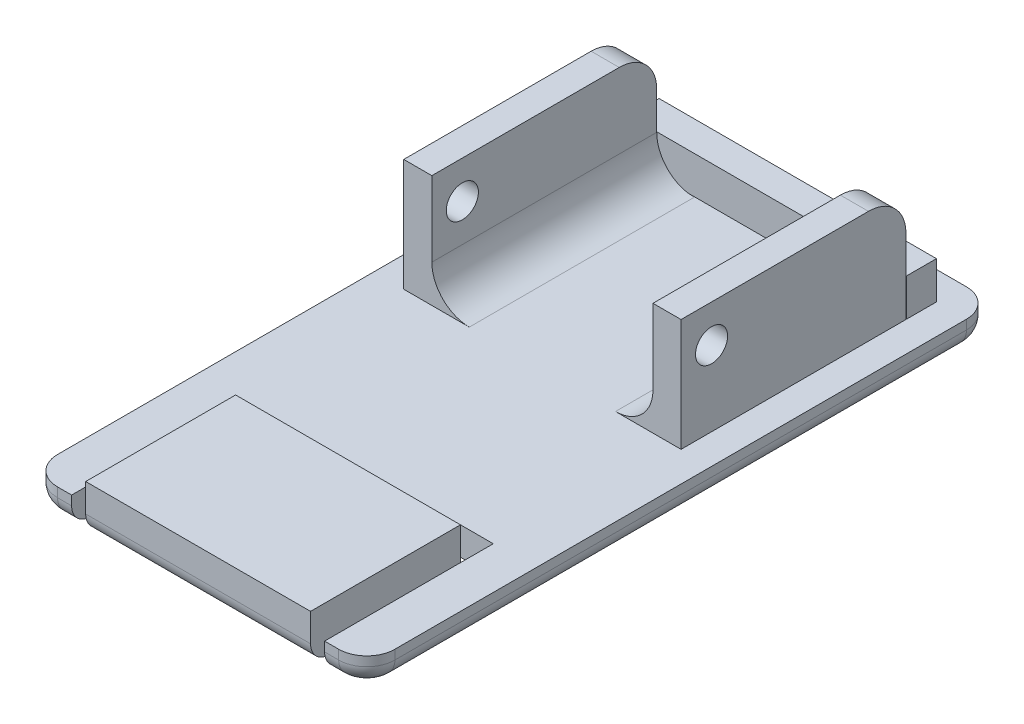
from build123d import *

# Parameters (mm, degrees)
SKETCH_1_W          = 18
SKETCH_1_H          = 33.5
EXTRUDE_1_DEPTH     = 1.5
FILLET_1_R          = 1.5
SKETCH_2_W          = 1.5
SKETCH_2_H          = 12
EXTRUDE_2_DEPTH     = 6
SKETCH_3_W          = 14.8
SKETCH_3_H          = 1.6
EXTRUDE_3_DEPTH     = 2
FILLET_2_R          = 2
SKETCH_4_R          = 0.856485036
CUT_EXTRUDE_1_DEPTH = 18
SKETCH_5_W          = 12
SKETCH_5_H          = 8
EXTRUDE_4_DEPTH     = 1
FILLET_3_R          = 1
CUT_EXTRUDE_2_DEPTH = 10


with BuildPart() as part:
    # 草图1 → 凸台-拉伸1 (new body)
    with BuildSketch(Plane(origin=(0, 0, 0), x_dir=(1, 0, 0), z_dir=(0, 1, 0))):
        Rectangle(SKETCH_1_W, SKETCH_1_H)
    extrude(amount=EXTRUDE_1_DEPTH)

    # 圆角1
    fillet_1_edges = [part.edges().sort_by_distance(p)[0] for p in [
        (-9, 0.75, -16.75),
        (9, 0.75, -16.75),
        (9, 0.75, 16.75),
        (-9, 0.75, 16.75),
    ]]
    fillet(fillet_1_edges, radius=FILLET_1_R)

    # 草图2 → 凸台-拉伸2 (add)
    with BuildSketch(Plane(origin=(0, 1.5, 0), x_dir=(1, 0, 0), z_dir=(0, 1, 0))):
        with Locations((-6.65, 7.622409508)):
            Rectangle(SKETCH_2_W, SKETCH_2_H)
        with Locations((6.65, 7.622409508)):
            Rectangle(SKETCH_2_W, SKETCH_2_H)
    extrude(amount=EXTRUDE_2_DEPTH)

    # 草图3 → 凸台-拉伸3 (add)
    with BuildSketch(Plane(origin=(0, 1.5, 0), x_dir=(1, 0, 0), z_dir=(0, 1, 0))):
        with Locations((0, 14.45)):
            Rectangle(SKETCH_3_W, SKETCH_3_H)
    extrude(amount=EXTRUDE_3_DEPTH)

    # 圆角2
    fillet_2_edges = [part.edges().sort_by_distance(p)[0] for p in [
        (-5.9, 1.5, -7.622409508),
        (-6.65, 7.5, -13.622409508),
        (5.9, 1.5, -7.622409508),
        (6.65, 7.5, -13.622409508),
    ]]
    fillet(fillet_2_edges, radius=FILLET_2_R)

    # 草图4 → 切除-拉伸1 (cut)
    with BuildSketch(Plane(origin=(7.4, 0, 0), x_dir=(0, 0, -1), z_dir=(1, 0, 0))):
        with Locations((3.25, 5.5)):
            Circle(SKETCH_4_R)
    extrude(amount=-CUT_EXTRUDE_1_DEPTH, mode=Mode.SUBTRACT)

    # 草图5 → 凸台-拉伸4 (add)
    with BuildSketch(Plane(origin=(0, 1.5, 0), x_dir=(1, 0, 0), z_dir=(0, 1, 0))):
        with Locations((0, -12.75)):
            Rectangle(SKETCH_5_W, SKETCH_5_H)
    extrude(amount=EXTRUDE_4_DEPTH)

    # 圆角3
    fillet_3_edges = [part.edges().sort_by_distance(p)[0] for p in [
        (9, 0, 0),
        (-9, 0, 0),
        (0, 0, -16.75),
        (0, 0, 16.75),
        (-8.560660172, 0, -16.310660172),
        (8.560660172, 0, -16.310660172),
        (-8.560660172, 0, 16.310660172),
        (8.560660172, 0, 16.310660172),
    ]]
    fillet(fillet_3_edges, radius=FILLET_3_R)

    # 草图6 → 切除-拉伸2 (cut)
    with BuildSketch(Plane(origin=(0, 1.5, 0), x_dir=(1, 0, 0), z_dir=(0, 1, 0))):
        Polygon((-6, -16.75), (-6.75, -16.75), (-6.75, -7.75), (-3, -7.75), (-3, -8.75), (-6, -8.75), align=None)
        Polygon((6, -8.75), (6, -16.75), (6.75, -16.75), (6.75, -7.75), (3, -7.75), (3, -8.75), align=None)
    extrude(amount=-CUT_EXTRUDE_2_DEPTH, mode=Mode.SUBTRACT)


solid = part.part
